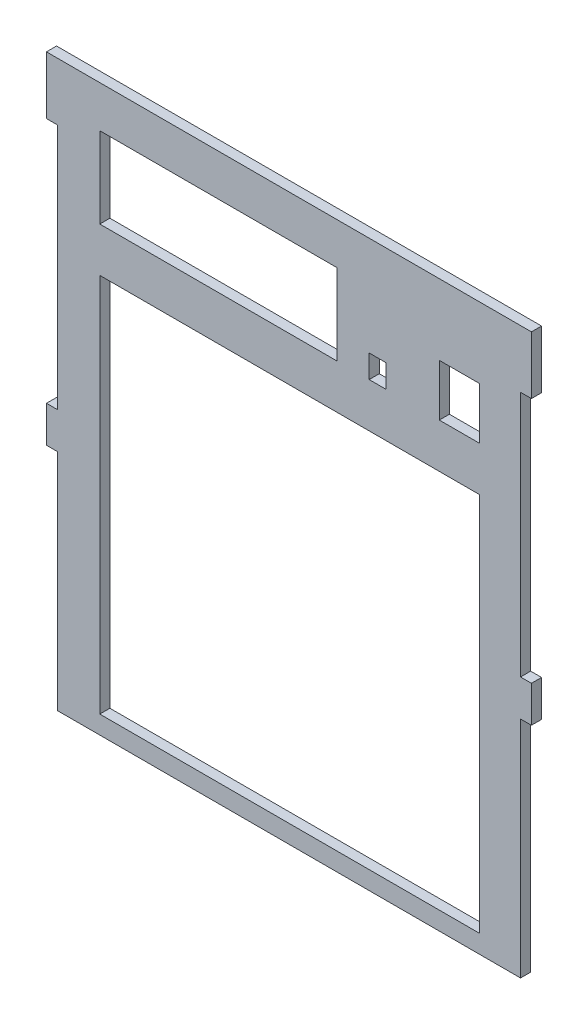
from build123d import *

# Parameters (mm, degrees)
SKETCH1_W           = 152.4
SKETCH1_H           = 241.3
BOSS_EXTRUDE1_DEPTH = 3.175
SKETCH2_W           = 3.429
SKETCH2_H           = 168.148
SKETCH2_H_2         = 40.386
CUT_EXTRUDE1_DEPTH  = 286.414664348
SKETCH3_W           = 119.38
SKETCH3_H           = 119.38
SKETCH3_W_2         = 74.6125
SKETCH3_H_2         = 25.4
SKETCH3_W_3         = 12.7
SKETCH3_H_3         = 16.256
SKETCH3_W_4         = 5.334
SKETCH3_H_4         = 7.239
CUT_EXTRUDE2_DEPTH  = 286.414664348
SKETCH4_W           = 184.697558878
SKETCH4_H           = 63.754
CUT_EXTRUDE5_DEPTH  = 286.414664348
SKETCH5_W           = 3.429
SKETCH5_H           = 11.43
BOSS_EXTRUDE2_DEPTH = 3.175


with BuildPart() as part:
    # Sketch1 → Boss-Extrude1 (new body)
    with BuildSketch(Plane.XY):
        with Locations((76.2, 120.65)):
            Rectangle(SKETCH1_W, SKETCH1_H)
    extrude(amount=BOSS_EXTRUDE1_DEPTH)

    # Sketch2 → Cut-Extrude1 (cut, through all)
    with BuildSketch(Plane.XY.offset(3.175)):
        with Locations((150.6855, 139.065)):
            Rectangle(SKETCH2_W, SKETCH2_H)
        with Locations((1.7145, 139.065)):
            Rectangle(SKETCH2_W, SKETCH2_H)
        with Locations((150.6855, 20.193)):
            Rectangle(SKETCH2_W, SKETCH2_H_2)
        with Locations((1.7145, 20.193)):
            Rectangle(SKETCH2_W, SKETCH2_H_2)
    extrude(amount=-CUT_EXTRUDE1_DEPTH, mode=Mode.SUBTRACT)

    # Sketch3 → Cut-Extrude2 (cut, through all)
    with BuildSketch(Plane.XY.offset(3.175)):
        Polygon((128.016, 57.15), (140.716, 57.15), (140.716, 44.45), align=None)
        Polygon((125.77093597, 42.20493597), (138.47093597, 42.20493597), (125.77093597, 54.90493597), align=None)
        Polygon((108.966, 57.15), (121.666, 57.15), (121.666, 44.45), align=None)
        Polygon((119.42093597, 42.20493597), (106.72093597, 54.90493597), (106.72093597, 42.20493597), align=None)
        Polygon((89.916, 57.15), (102.616, 57.15), (102.616, 44.45), align=None)
        Polygon((100.37093597, 42.20493597), (87.67093597, 54.90493597), (87.67093597, 42.20493597), align=None)
        Polygon((70.866, 57.15), (83.566, 57.15), (83.566, 44.45), align=None)
        Polygon((81.32093597, 42.20493597), (68.62093597, 54.90493597), (68.62093597, 42.20493597), align=None)
        Polygon((51.816, 57.15), (64.516, 57.15), (64.516, 44.45), align=None)
        Polygon((62.27093597, 42.20493597), (49.57093597, 54.90493597), (49.57093597, 42.20493597), align=None)
        Polygon((32.766, 57.15), (45.466, 57.15), (45.466, 44.45), align=None)
        Polygon((43.22093597, 42.20493597), (30.52093597, 54.90493597), (30.52093597, 42.20493597), align=None)
        Polygon((13.716, 57.15), (26.416, 57.15), (26.416, 44.45), align=None)
        Polygon((24.17093597, 42.20493597), (11.47093597, 54.90493597), (11.47093597, 42.20493597), align=None)
        Polygon((128.016, 38.1), (140.716, 38.1), (140.716, 25.4), align=None)
        with Locations((76.454, 129.159)):
            Rectangle(SKETCH3_W, SKETCH3_H)
        Polygon((125.77093597, 23.15493597), (138.47093597, 23.15493597), (125.77093597, 35.85493597), align=None)
        Polygon((108.966, 38.1), (121.666, 38.1), (121.666, 25.4), align=None)
        Polygon((119.42093597, 23.15493597), (106.72093597, 35.85493597), (106.72093597, 23.15493597), align=None)
        Polygon((89.916, 38.1), (102.616, 38.1), (102.616, 25.4), align=None)
        Polygon((100.37093597, 23.15493597), (87.67093597, 35.85493597), (87.67093597, 23.15493597), align=None)
        Polygon((70.866, 38.1), (83.566, 38.1), (83.566, 25.4), align=None)
        Polygon((81.32093597, 23.15493597), (68.62093597, 35.85493597), (68.62093597, 23.15493597), align=None)
        Polygon((51.816, 38.1), (64.516, 38.1), (64.516, 25.4), align=None)
        Polygon((62.27093597, 23.15493597), (49.57093597, 35.85493597), (49.57093597, 23.15493597), align=None)
        Polygon((32.766, 38.1), (45.466, 38.1), (45.466, 25.4), align=None)
        Polygon((43.22093597, 23.15493597), (30.52093597, 35.85493597), (30.52093597, 23.15493597), align=None)
        Polygon((13.716, 38.1), (26.416, 38.1), (26.416, 25.4), align=None)
        Polygon((24.17093597, 23.15493597), (11.47093597, 35.85493597), (11.47093597, 23.15493597), align=None)
        Polygon((128.016, 19.05), (140.716, 19.05), (140.716, 6.35), align=None)
        Polygon((125.77093597, 4.10493597), (138.47093597, 4.10493597), (125.77093597, 16.80493597), align=None)
        Polygon((108.966, 19.05), (121.666, 19.05), (121.666, 6.35), align=None)
        Polygon((119.42093597, 4.10493597), (106.72093597, 16.80493597), (106.72093597, 4.10493597), align=None)
        Polygon((89.916, 19.05), (102.616, 19.05), (102.616, 6.35), align=None)
        Polygon((100.37093597, 4.10493597), (87.67093597, 16.80493597), (87.67093597, 4.10493597), align=None)
        Polygon((70.866, 19.05), (83.566, 19.05), (83.566, 6.35), align=None)
        Polygon((81.32093597, 4.10493597), (68.62093597, 16.80493597), (68.62093597, 4.10493597), align=None)
        Polygon((51.816, 19.05), (64.516, 19.05), (64.516, 6.35), align=None)
        Polygon((62.27093597, 4.10493597), (49.57093597, 16.80493597), (49.57093597, 4.10493597), align=None)
        Polygon((32.766, 19.05), (45.466, 19.05), (45.466, 6.35), align=None)
        Polygon((43.22093597, 4.10493597), (30.52093597, 16.80493597), (30.52093597, 4.10493597), align=None)
        Polygon((13.716, 19.05), (26.416, 19.05), (26.416, 6.35), align=None)
        Polygon((24.17093597, 4.10493597), (11.47093597, 16.80493597), (11.47093597, 4.10493597), align=None)
        with Locations((54.07025, 215.519)):
            Rectangle(SKETCH3_W_2, SKETCH3_H_2)
        with Locations((129.794, 210.947)):
            Rectangle(SKETCH3_W_3, SKETCH3_H_3)
        with Locations((104.0765, 206.4385)):
            Rectangle(SKETCH3_W_4, SKETCH3_H_4)
    extrude(amount=-CUT_EXTRUDE2_DEPTH, mode=Mode.SUBTRACT)

    # Sketch4 → Cut-Extrude5 (cut, through all)
    with BuildSketch(Plane.XY.offset(3.175)):
        with Locations((77.04209933, 31.877)):
            Rectangle(SKETCH4_W, SKETCH4_H)
    extrude(amount=-CUT_EXTRUDE5_DEPTH, mode=Mode.SUBTRACT)

    # Sketch5 → Boss-Extrude2 (add)
    with BuildSketch(Plane.XY.offset(3.175)):
        with Locations((1.7145, 139.954)):
            Rectangle(SKETCH5_W, SKETCH5_H)
        with Locations((150.6855, 139.954)):
            Rectangle(SKETCH5_W, SKETCH5_H)
    extrude(amount=-BOSS_EXTRUDE2_DEPTH)


solid = part.part
